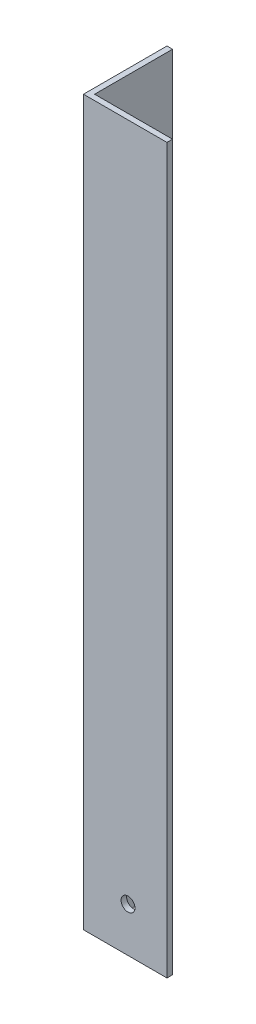
from build123d import *

# Parameters (mm, degrees)
SKETCH_1_W      = 15
SKETCH_1_H      = 1
EXTRUDE_1_DEPTH = 130
SKETCH_3_W      = 1
SKETCH_3_H      = 130
EXTRUDE_2_DEPTH = 14
M3X0_5_2_D      = 2.5


with BuildPart() as part:
    # ｽｹｯﾁ1 → ﾎﾞｽ - 押し出し1 (new body)
    with BuildSketch(Plane(origin=(0, 0, 0), x_dir=(1, 0, 0), z_dir=(0, 1, 0))):
        with Locations((7.5, -0.5)):
            Rectangle(SKETCH_1_W, SKETCH_1_H)
    extrude(amount=EXTRUDE_1_DEPTH)

    # ｽｹｯﾁ3 → ﾎﾞｽ - 押し出し2 (add)
    with BuildSketch(Plane(origin=(0, 0, 0), x_dir=(-1, 0, 0), z_dir=(0, 0, -1))):
        with Locations((-0.5, 65)):
            Rectangle(SKETCH_3_W, SKETCH_3_H)
    extrude(amount=EXTRUDE_2_DEPTH)

    # M3x0.5 ねじ穴2 (through all)
    with Locations(Plane.XY.offset(1)):
        with Locations((8, 8)):
            Hole(M3X0_5_2_D / 2)


solid = part.part
